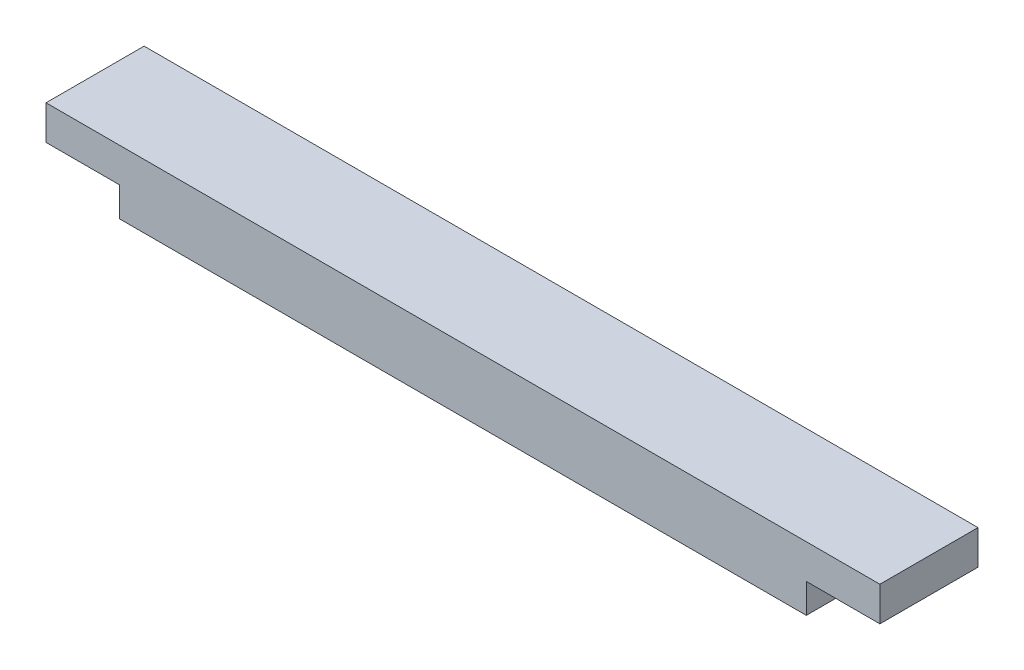
from build123d import *

# Parameters (mm, degrees)
IZIM1_W                     = 140
IZIM1_H                     = 20
Y_KSEKLIK_EKSTR_ZYON1_DEPTH = 6
IZIM2_W                     = 170
IZIM2_H                     = 20
Y_KSEKLIK_EKSTR_ZYON2_DEPTH = 7


with BuildPart() as part:
    # Çizim1 → Yükseklik-Ekstrüzyon1 (new body)
    with BuildSketch(Plane(origin=(0, 0, 0), x_dir=(1, 0, 0), z_dir=(0, 1, 0))):
        Rectangle(IZIM1_W, IZIM1_H)
    extrude(amount=Y_KSEKLIK_EKSTR_ZYON1_DEPTH)

    # Çizim2 → Yükseklik-Ekstrüzyon2 (add)
    with BuildSketch(Plane(origin=(0, 6, 0), x_dir=(1, 0, 0), z_dir=(0, 1, 0))):
        Rectangle(IZIM2_W, IZIM2_H)
    extrude(amount=Y_KSEKLIK_EKSTR_ZYON2_DEPTH)


solid = part.part
